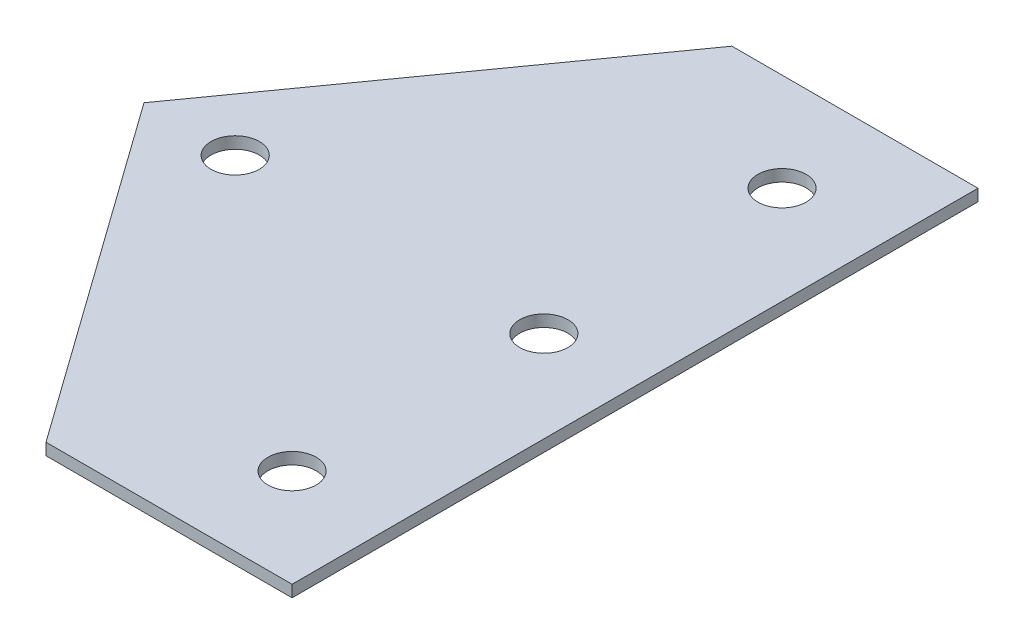
from build123d import *

# Parameters (mm, degrees)
BOSS_EXTRUDE1_DEPTH = 6.096
SKETCH3_R           = 12.5
CUT_EXTRUDE1_DEPTH  = 44.45
SKETCH4_R           = 12.5
CUT_EXTRUDE2_DEPTH  = 6.096


with BuildPart() as part:
    # Sketch1 → Boss-Extrude1 (new body)
    with BuildSketch(Plane(origin=(0, 0, 0), x_dir=(1, 0, 0), z_dir=(0, 1, 0))):
        Polygon((-63.779220614, -177.8), (-190.779220614, 0), (-63.779220614, 177.8), (63.779220614, 177.8), (63.779220614, -177.8), align=None)
    extrude(amount=BOSS_EXTRUDE1_DEPTH)

    # Sketch3 → Cut-Extrude1 (cut)
    with BuildSketch(Plane(origin=(0, 6.096, 0), x_dir=(1, 0, 0), z_dir=(0, 1, 0))):
        with Locations(Location((-143.5, 0, 0), (0, 0, 270))):
            Circle(SKETCH3_R)
        with Locations(Location((16.5, 0, 0), (0, 0, 270))):
            Circle(SKETCH3_R)
    extrude(amount=-CUT_EXTRUDE1_DEPTH, mode=Mode.SUBTRACT)

    # Sketch4 → Cut-Extrude2 (cut)
    with BuildSketch(Plane.XZ):
        with Locations(Location((12.979220614, 127, 0), (0, 0, 270))):
            Circle(SKETCH4_R)
        with Locations(Location((12.979220614, -127, 0), (0, 0, 90))):
            Circle(SKETCH4_R)
    extrude(amount=-CUT_EXTRUDE2_DEPTH, mode=Mode.SUBTRACT)


solid = part.part
